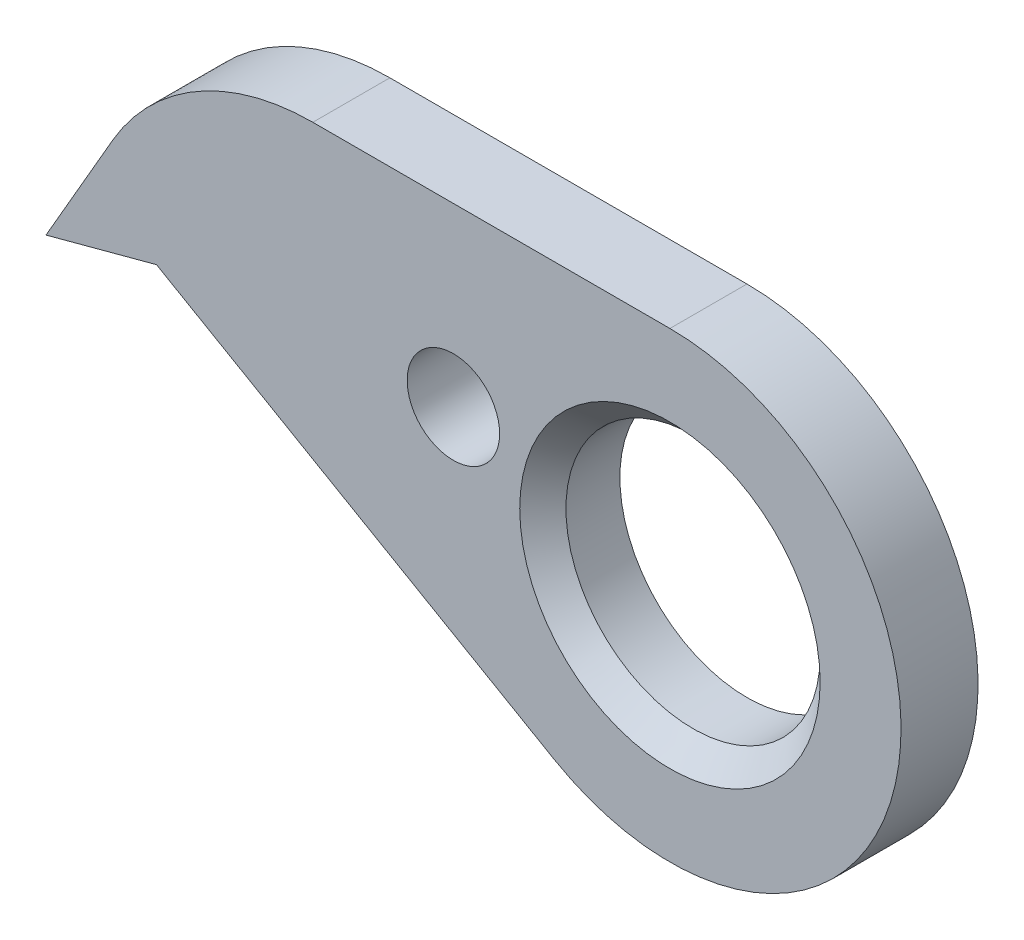
from build123d import *

# Parameters (mm, degrees)
BOSS_EXTRUDE1_DEPTH        = 1
CUT_EXTRUDE1_REACH         = 10.695
SKETCH2_R                  = 1.65
CHAMFER1_SIZE              = 0.3
F_1_2_1_2_DIAMETER_HOLE1_D = 1.2


with BuildPart() as part:
    # Sketch1 → Boss-Extrude1 (new body)
    with BuildSketch(Plane.XY):
        with BuildLine():
            Line((0, 3), (-4.635898385, 3))
            ThreePointArc((-4.635898385, 3), (-6.135898385, 2.598076211), (-7.233974596, 1.5))
            Line((-7.233974596, 1.5), (-8.1, 0))
            Line((-8.1, 0), (-6.665673326, 0.384326674))
            Line((-6.665673326, 0.384326674), (-1.5, -2.598076211))
            ThreePointArc((-1.5, -2.598076211), (2.897777479, -0.776457135), (0, 3))
        make_face()
    extrude(amount=-BOSS_EXTRUDE1_DEPTH)

    # Sketch2 → Cut-Extrude1 (cut, up to next)
    with BuildSketch(Plane.XY, mode=Mode.PRIVATE) as cut_extrude1_sk1:
        Circle(SKETCH2_R)
    cut_extrude1_tool1 = extrude(cut_extrude1_sk1.sketch, amount=-CUT_EXTRUDE1_REACH, mode=Mode.PRIVATE) & part.part
    add(cut_extrude1_tool1.solids().sort_by_distance((0, 0, 0))[0], mode=Mode.SUBTRACT)

    # Chamfer1
    chamfer1_edges = [part.edges().sort_by_distance(p)[0] for p in [
        (-1.65, 0, 0),
    ]]
    chamfer(chamfer1_edges, length=CHAMFER1_SIZE)

    # Ø1.2 (1.2) Diameter Hole1 (through all)
    with Locations(Plane.XY):
        with Locations((-2.811389139, 0.711400806)):
            Hole(F_1_2_1_2_DIAMETER_HOLE1_D / 2)


solid = part.part
